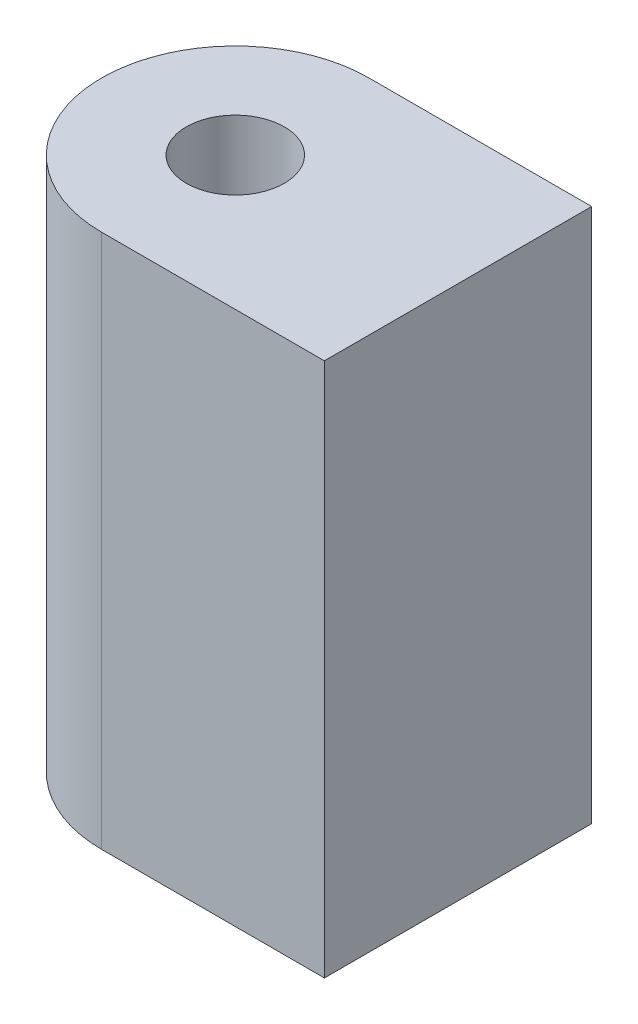
from build123d import *

# Parameters (mm, degrees)
SKETCH1_R           = 2.75
BOSS_EXTRUDE1_DEPTH = 30


with BuildPart() as part:
    # Sketch1 → Boss-Extrude1 (new body)
    with BuildSketch(Plane(origin=(0, 0, 0), x_dir=(1, 0, 0), z_dir=(0, 1, 0))):
        with BuildLine():
            Line((0, 7.5), (-12.5, 7.5))
            ThreePointArc((-12.5, 7.5), (-20, 0), (-12.5, -7.5))
            Line((-12.5, -7.5), (0, -7.5))
            Line((0, -7.5), (0, 7.5))
        make_face()
        with Locations(Location((-12.5, 0, 0), (0, 0, 270))):
            Circle(SKETCH1_R, mode=Mode.SUBTRACT)
    extrude(amount=BOSS_EXTRUDE1_DEPTH)


solid = part.part
